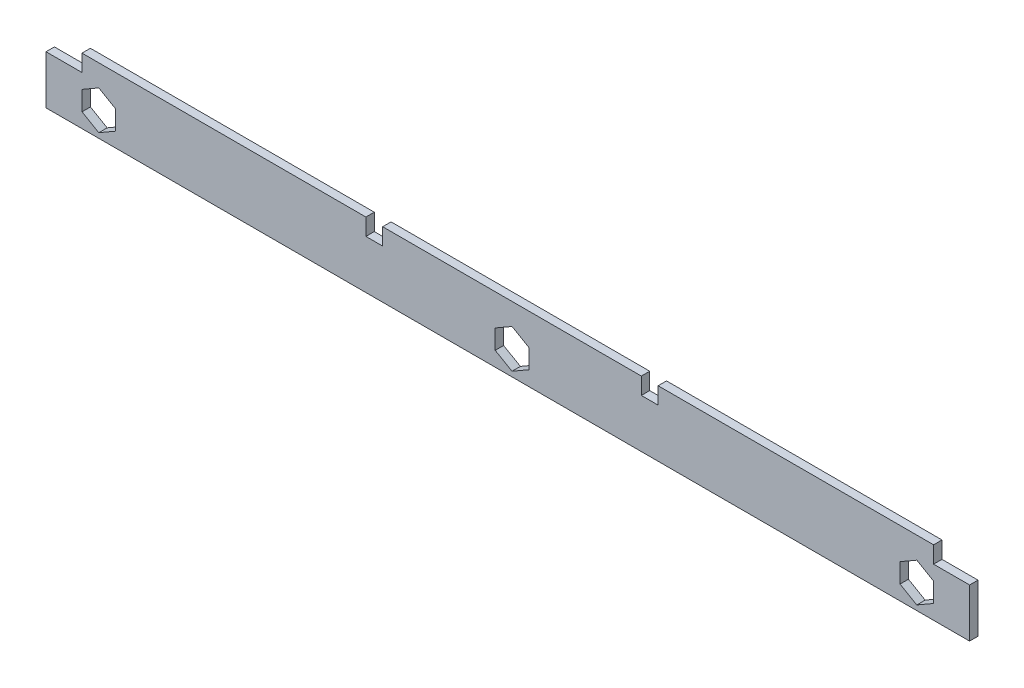
from build123d import *

# Parameters (mm, degrees)
BOSS_EXTRUDE1_DEPTH = 1.5875


with BuildPart() as part:
    # Sketch1 → Boss-Extrude1 (new body)
    with BuildSketch(Plane.XY):
        Polygon((6607.534727104, 2635.321979213), (6607.534727104, 2638.496979213), (6555.452027104, 2638.496979213), (6555.452027104, 2635.321979213), (6552.277027104, 2635.321979213), (6552.277027104, 2638.496979213), (6503.374423235, 2638.496979213), (6503.374423235, 2635.321979213), (6500.199423235, 2635.321979213), (6500.199423235, 2638.496979213), (6446.524127104, 2638.496979213), (6446.524127104, 2635.321979213), (6439.716927104, 2635.321979213), (6439.716927104, 2626.127179213), (6614.341927104, 2626.127179213), (6614.341927104, 2635.321979213), align=None)
        Polygon((6531.000725169, 2632.557666317), (6527.825725169, 2634.390753422), (6524.650725169, 2632.557666317), (6524.650725169, 2628.891492108), (6527.825725169, 2627.058405003), (6531.000725169, 2628.891492108), align=None, mode=Mode.SUBTRACT)
        Polygon((6452.874127104, 2632.557666317), (6449.699127104, 2634.390753422), (6446.524127104, 2632.557666317), (6446.524127104, 2628.891492108), (6449.699127104, 2627.058405003), (6452.874127104, 2628.891492108), align=None, mode=Mode.SUBTRACT)
        Polygon((6607.534727104, 2632.557666317), (6604.359727104, 2634.390753422), (6601.184727104, 2632.557666317), (6601.184727104, 2628.891492108), (6604.359727104, 2627.058405003), (6607.534727104, 2628.891492108), align=None, mode=Mode.SUBTRACT)
    extrude(amount=BOSS_EXTRUDE1_DEPTH)


solid = part.part
